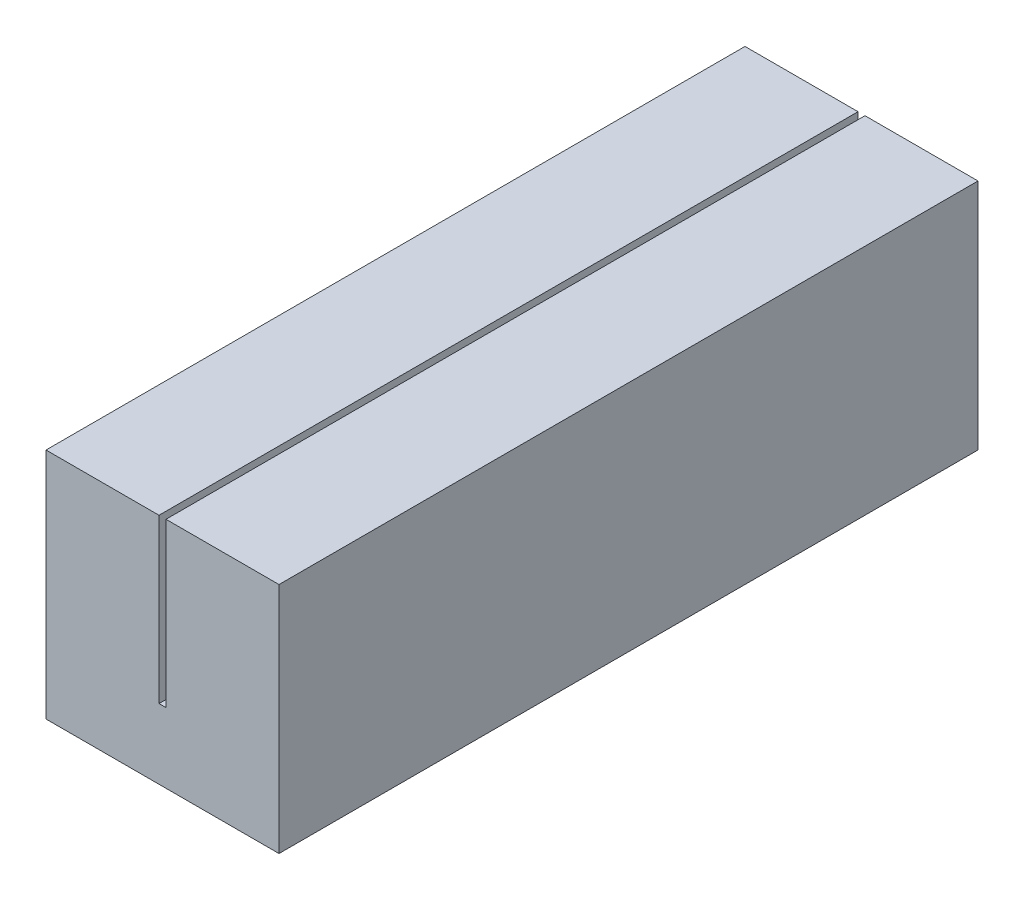
from build123d import *

# Parameters (mm, degrees)
BOSS_EXTRUDE1_DEPTH = 15


with BuildPart() as part:
    # Sketch1 → Boss-Extrude1 (new, symmetric)
    with BuildSketch(Plane.XY):
        Polygon((-0.15, 5), (-0.15, -2), (0.15, -2), (0.15, 5), (5, 5), (5, -5), (-5, -5), (-5, 5), align=None)
    extrude(amount=BOSS_EXTRUDE1_DEPTH, both=True)


solid = part.part
